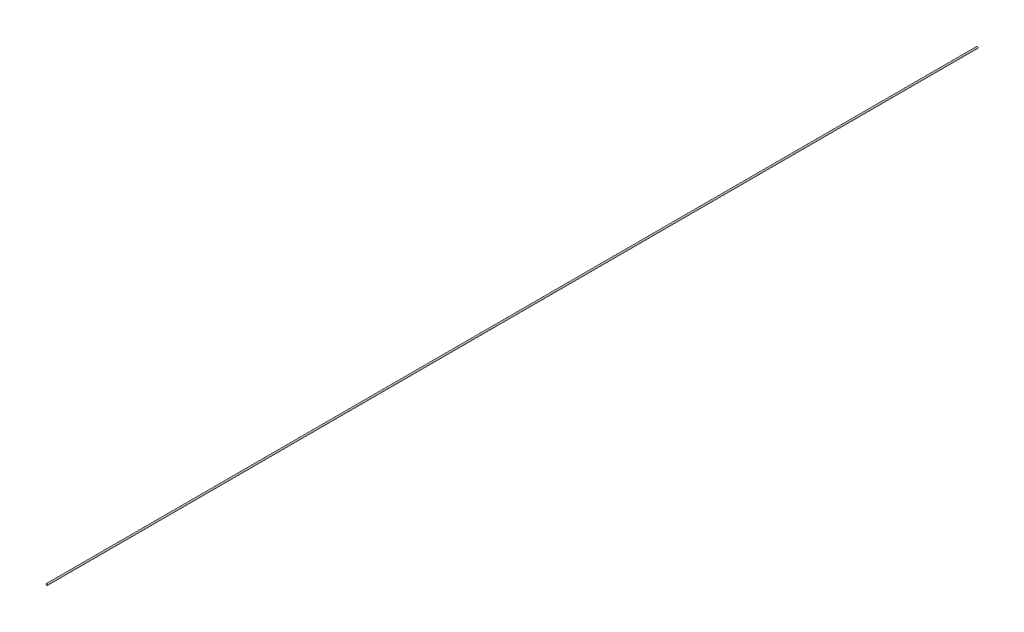
from build123d import *

# Parameters (mm, degrees)
SKETCH_1_R      = 0.2
EXTRUDE_1_DEPTH = 233.5


with BuildPart() as part:
    # 草图1 → 凸台-拉伸1 (new body)
    with BuildSketch(Plane.XY):
        Circle(SKETCH_1_R)
    extrude(amount=EXTRUDE_1_DEPTH)


solid = part.part
